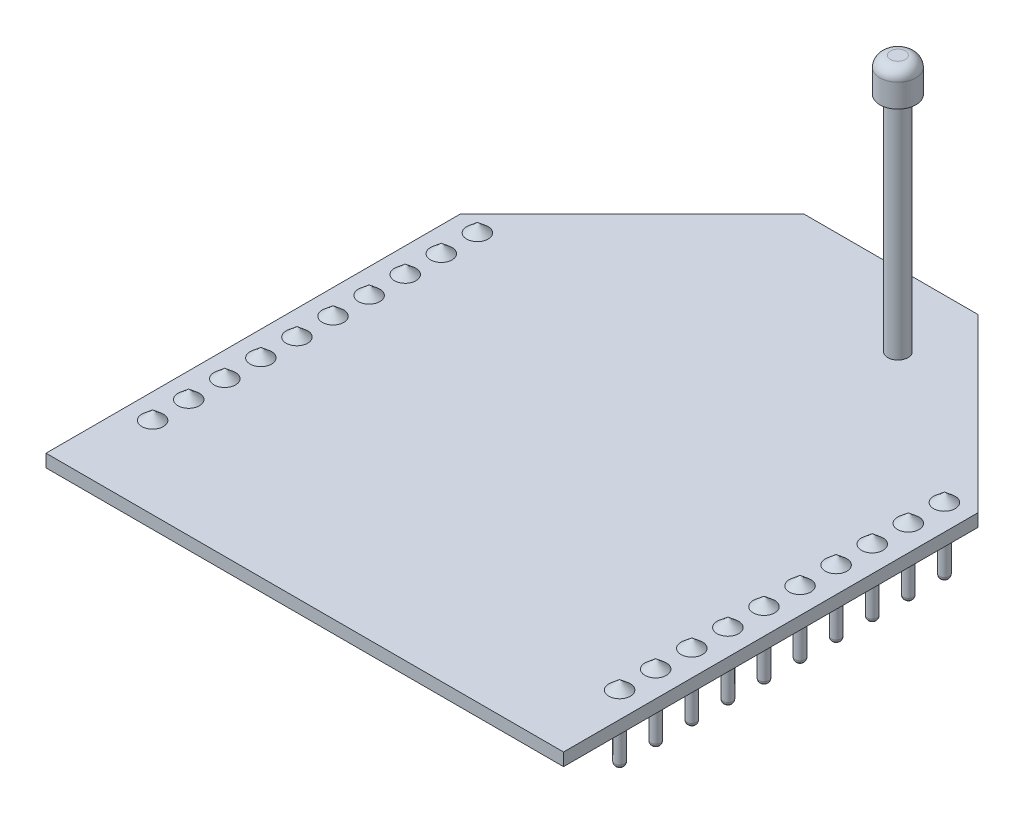
from build123d import *

# Parameters (mm, degrees)
BOSS_EXTRUDE1_DEPTH = 0.6
LPATTERN1_COUNT     = 2
LPATTERN1_PITCH     = 22
LPATTERN1_2_COUNT   = 10
LPATTERN1_2_PITCH   = 1.7
SKETCH2_R           = 0.229633819
BOSS_EXTRUDE3_DEPTH = 2.5
FILLET1_R           = 0.2
FILLET2_R           = 0.2
SKETCH3_R           = 0.478057015
BOSS_EXTRUDE4_DEPTH = 10.5
SKETCH4_R           = 0.85
BOSS_EXTRUDE5_DEPTH = 1.6
FILLET3_R           = 0.5


with BuildPart() as part:
    # Sketch1 → Boss-Extrude1 (new body)
    with BuildSketch(Plane(origin=(0, 0, 0), x_dir=(1, 0, 0), z_dir=(0, 1, 0))):
        Polygon((-7.214489796, 10.759540816), (-15.299693878, 2.674336735), (-15.299693878, -16.850459184), (9.080306122, -16.850459184), (9.080306122, 2.674336735), (0.995102041, 10.759540816), align=None)
    extrude(amount=-BOSS_EXTRUDE1_DEPTH)

    # Sketch2 → Boss-Extrude3 (add)
    with BuildSketch(Plane.XZ.offset(0.6)):
        with Locations((-14.128367952, -2.300454228)):
            Circle(SKETCH2_R)
        with Locations((7.871632048, -2.300454228)):
            Circle(SKETCH2_R)
        with Locations((7.871632048, -0.600454228)):
            Circle(SKETCH2_R)
        with Locations((7.871632048, 1.099545772)):
            Circle(SKETCH2_R)
        with Locations((7.871632048, 2.799545772)):
            Circle(SKETCH2_R)
        with Locations((7.871632048, 4.499545772)):
            Circle(SKETCH2_R)
        with Locations((7.871632048, 6.199545772)):
            Circle(SKETCH2_R)
        with Locations((7.871632048, 7.899545772)):
            Circle(SKETCH2_R)
        with Locations((7.871632048, 9.599545772)):
            Circle(SKETCH2_R)
        with Locations((7.871632048, 11.299545772)):
            Circle(SKETCH2_R)
        with Locations((7.871632048, 12.999545772)):
            Circle(SKETCH2_R)
        with Locations((-14.128367952, -0.600454228)):
            Circle(SKETCH2_R)
        with Locations((-14.128367952, 1.099545772)):
            Circle(SKETCH2_R)
        with Locations((-14.128367952, 2.799545772)):
            Circle(SKETCH2_R)
        with Locations((-14.128367952, 4.499545772)):
            Circle(SKETCH2_R)
        with Locations((-14.128367952, 6.199545772)):
            Circle(SKETCH2_R)
        with Locations((-14.128367952, 7.899545772)):
            Circle(SKETCH2_R)
        with Locations((-14.128367952, 9.599545772)):
            Circle(SKETCH2_R)
        with Locations((-14.128367952, 11.299545772)):
            Circle(SKETCH2_R)
        with Locations((-14.128367952, 12.999545772)):
            Circle(SKETCH2_R)
    extrude(amount=BOSS_EXTRUDE3_DEPTH)

    # Fillet1
    fillet1_edges = [part.edges().sort_by_distance(p)[0] for p in [
        (-14.358001771, -3.1, -2.300454228),
    ]]
    fillet(fillet1_edges, radius=FILLET1_R)

    # Fillet2
    fillet2_edges = [part.edges().sort_by_distance(p)[0] for p in [
        (7.641998229, -3.1, 1.099545772),
        (7.641998229, -3.1, 2.799545772),
        (7.641998229, -3.1, 4.499545772),
        (7.641998229, -3.1, 6.199545772),
        (7.641998229, -3.1, 9.599545772),
        (7.641998229, -3.1, -2.300454228),
        (7.641998229, -3.1, -0.600454228),
        (7.641998229, -3.1, 7.899545772),
        (7.641998229, -3.1, 11.299545772),
        (7.641998229, -3.1, 12.999545772),
        (-14.358001771, -3.1, 12.999545772),
        (-14.358001771, -3.1, 11.299545772),
        (-14.358001771, -3.1, 9.599545772),
        (-14.358001771, -3.1, 7.899545772),
        (-14.358001771, -3.1, 6.199545772),
        (-14.358001771, -3.1, 4.499545772),
        (-14.358001771, -3.1, 2.799545772),
        (-14.358001771, -3.1, 1.099545772),
        (-14.358001771, -3.1, -0.600454228),
    ]]
    fillet(fillet2_edges, radius=FILLET2_R)

    # Sketch3 → Boss-Extrude4 (add)
    with BuildSketch(Plane(origin=(0, 0, 0), x_dir=(1, 0, 0), z_dir=(0, 1, 0))):
        with Locations((0.629310256, 7.351261494)):
            Circle(SKETCH3_R)
    extrude(amount=BOSS_EXTRUDE4_DEPTH)

    # Sketch4 → Boss-Extrude5 (add)
    with BuildSketch(Plane(origin=(0, 10.5, 0), x_dir=(1, 0, 0), z_dir=(0, 1, 0))):
        with Locations((0.629310256, 7.351261494)):
            Circle(SKETCH4_R)
    extrude(amount=BOSS_EXTRUDE5_DEPTH)

    # Fillet3
    fillet3_edges = [part.edges().sort_by_distance(p)[0] for p in [
        (-0.220689744, 12.1, -7.351261494),
    ]]
    fillet(fillet3_edges, radius=FILLET3_R)


with BuildPart() as body_2:
    # Boss-Extrude2 cone 1 section (through the dimple's axis) → Boss-Extrude2 (revolve)
    with BuildSketch(Plane(origin=(-14.128367952, 0, -2.300454228), x_dir=(0, 0, -1), z_dir=(1, 0, 0))):
        Polygon((0, 0), (0.507815391, 0), (0, 0.426107707), align=None)
    revolve(axis=Axis((-14.128367952, 0, -2.300454228), (0, 1, 0)))


with BuildPart() as lpattern1_1:
    # LPattern1: pattern copy
    add(body_2.part.moved(Location(Vector(1, 0, 0) * (1 * LPATTERN1_PITCH))))


with BuildPart() as lpattern1_2_1:
    # LPattern1 2: pattern copy
    add(body_2.part.moved(Location(Vector(0, 0, 1) * (1 * LPATTERN1_2_PITCH))))


with BuildPart() as lpattern1_2_2:
    # LPattern1 2: pattern copy
    add(body_2.part.moved(Location(Vector(0, 0, 1) * (2 * LPATTERN1_2_PITCH))))


with BuildPart() as lpattern1_2_3:
    # LPattern1 2: pattern copy
    add(body_2.part.moved(Location(Vector(0, 0, 1) * (3 * LPATTERN1_2_PITCH))))


with BuildPart() as lpattern1_2_4:
    # LPattern1 2: pattern copy
    add(body_2.part.moved(Location(Vector(0, 0, 1) * (4 * LPATTERN1_2_PITCH))))


with BuildPart() as lpattern1_2_5:
    # LPattern1 2: pattern copy
    add(body_2.part.moved(Location(Vector(0, 0, 1) * (5 * LPATTERN1_2_PITCH))))


with BuildPart() as lpattern1_2_6:
    # LPattern1 2: pattern copy
    add(body_2.part.moved(Location(Vector(0, 0, 1) * (6 * LPATTERN1_2_PITCH))))


with BuildPart() as lpattern1_2_7:
    # LPattern1 2: pattern copy
    add(body_2.part.moved(Location(Vector(0, 0, 1) * (7 * LPATTERN1_2_PITCH))))


with BuildPart() as lpattern1_2_8:
    # LPattern1 2: pattern copy
    add(body_2.part.moved(Location(Vector(0, 0, 1) * (8 * LPATTERN1_2_PITCH))))


with BuildPart() as lpattern1_2_9:
    # LPattern1 2: pattern copy
    add(body_2.part.moved(Location(Vector(0, 0, 1) * (9 * LPATTERN1_2_PITCH))))


with BuildPart() as lpattern1_2_10:
    # LPattern1 2: pattern copy
    add(lpattern1_1.part.moved(Location(Vector(0, 0, 1) * (1 * LPATTERN1_2_PITCH))))


with BuildPart() as lpattern1_2_11:
    # LPattern1 2: pattern copy
    add(lpattern1_1.part.moved(Location(Vector(0, 0, 1) * (2 * LPATTERN1_2_PITCH))))


with BuildPart() as lpattern1_2_12:
    # LPattern1 2: pattern copy
    add(lpattern1_1.part.moved(Location(Vector(0, 0, 1) * (3 * LPATTERN1_2_PITCH))))


with BuildPart() as lpattern1_2_13:
    # LPattern1 2: pattern copy
    add(lpattern1_1.part.moved(Location(Vector(0, 0, 1) * (4 * LPATTERN1_2_PITCH))))


with BuildPart() as lpattern1_2_14:
    # LPattern1 2: pattern copy
    add(lpattern1_1.part.moved(Location(Vector(0, 0, 1) * (5 * LPATTERN1_2_PITCH))))


with BuildPart() as lpattern1_2_15:
    # LPattern1 2: pattern copy
    add(lpattern1_1.part.moved(Location(Vector(0, 0, 1) * (6 * LPATTERN1_2_PITCH))))


with BuildPart() as lpattern1_2_16:
    # LPattern1 2: pattern copy
    add(lpattern1_1.part.moved(Location(Vector(0, 0, 1) * (7 * LPATTERN1_2_PITCH))))


with BuildPart() as lpattern1_2_17:
    # LPattern1 2: pattern copy
    add(lpattern1_1.part.moved(Location(Vector(0, 0, 1) * (8 * LPATTERN1_2_PITCH))))


with BuildPart() as lpattern1_2_18:
    # LPattern1 2: pattern copy
    add(lpattern1_1.part.moved(Location(Vector(0, 0, 1) * (9 * LPATTERN1_2_PITCH))))


solid = Compound([part.part, body_2.part, lpattern1_1.part, lpattern1_2_1.part, lpattern1_2_2.part, lpattern1_2_3.part, lpattern1_2_4.part, lpattern1_2_5.part, lpattern1_2_6.part, lpattern1_2_7.part, lpattern1_2_8.part, lpattern1_2_9.part, lpattern1_2_10.part, lpattern1_2_11.part, lpattern1_2_12.part, lpattern1_2_13.part, lpattern1_2_14.part, lpattern1_2_15.part, lpattern1_2_16.part, lpattern1_2_17.part, lpattern1_2_18.part])
